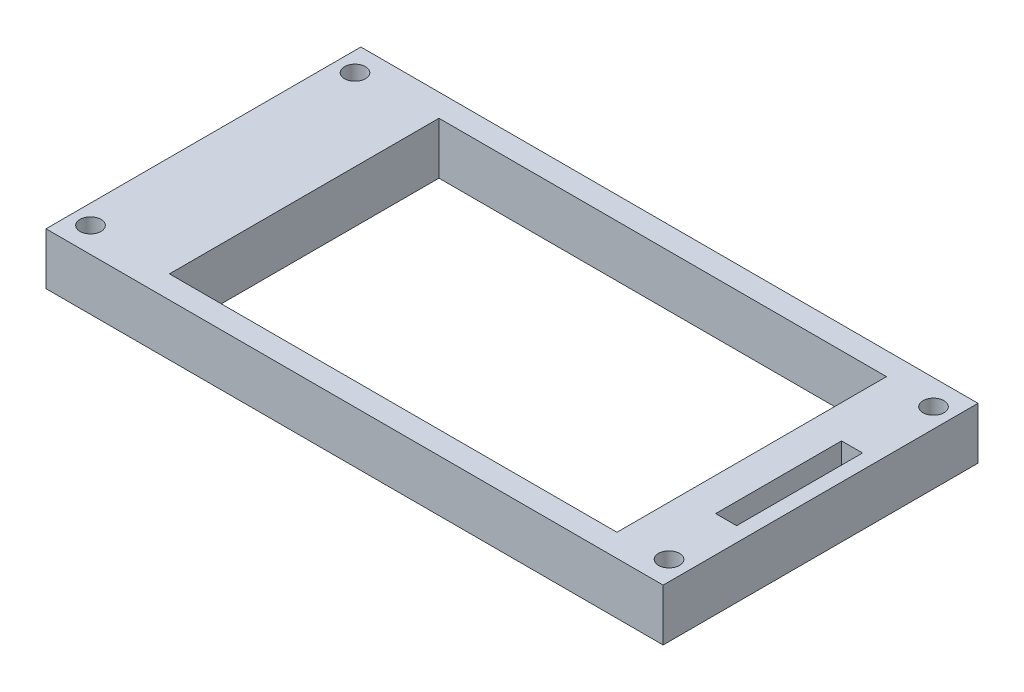
from build123d import *

# Parameters (mm, degrees)
SKETCH1_W           = 73.5
SKETCH1_H           = 37.5
SKETCH1_R           = 1.25
SKETCH1_W_2         = 53.3
SKETCH1_H_2         = 32.1
SKETCH1_W_3         = 2.5
SKETCH1_H_3         = 15
BOSS_EXTRUDE1_DEPTH = 6.18


with BuildPart() as part:
    # Sketch1 → Boss-Extrude1 (new body)
    with BuildSketch(Plane(origin=(0, 0, 0), x_dir=(1, 0, 0), z_dir=(0, 1, 0))):
        with Locations((36.75, -18.75)):
            Rectangle(SKETCH1_W, SKETCH1_H)
        with Locations(Location((2.3, -34.5, 0), (0, 0, 270))):
            Circle(SKETCH1_R, mode=Mode.SUBTRACT)
        with Locations(Location((2.3, -3, 0), (0, 0, 270))):
            Circle(SKETCH1_R, mode=Mode.SUBTRACT)
        with Locations((38.65, -18.75)):
            Rectangle(SKETCH1_W_2, SKETCH1_H_2, mode=Mode.SUBTRACT)
        with Locations(Location((71.2, -3, 0), (0, 0, 270))):
            Circle(SKETCH1_R, mode=Mode.SUBTRACT)
        with Locations(Location((71.2, -34.5, 0), (0, 0, 270))):
            Circle(SKETCH1_R, mode=Mode.SUBTRACT)
        with Locations((70.5, -19.5)):
            Rectangle(SKETCH1_W_3, SKETCH1_H_3, mode=Mode.SUBTRACT)
    extrude(amount=BOSS_EXTRUDE1_DEPTH)


solid = part.part
